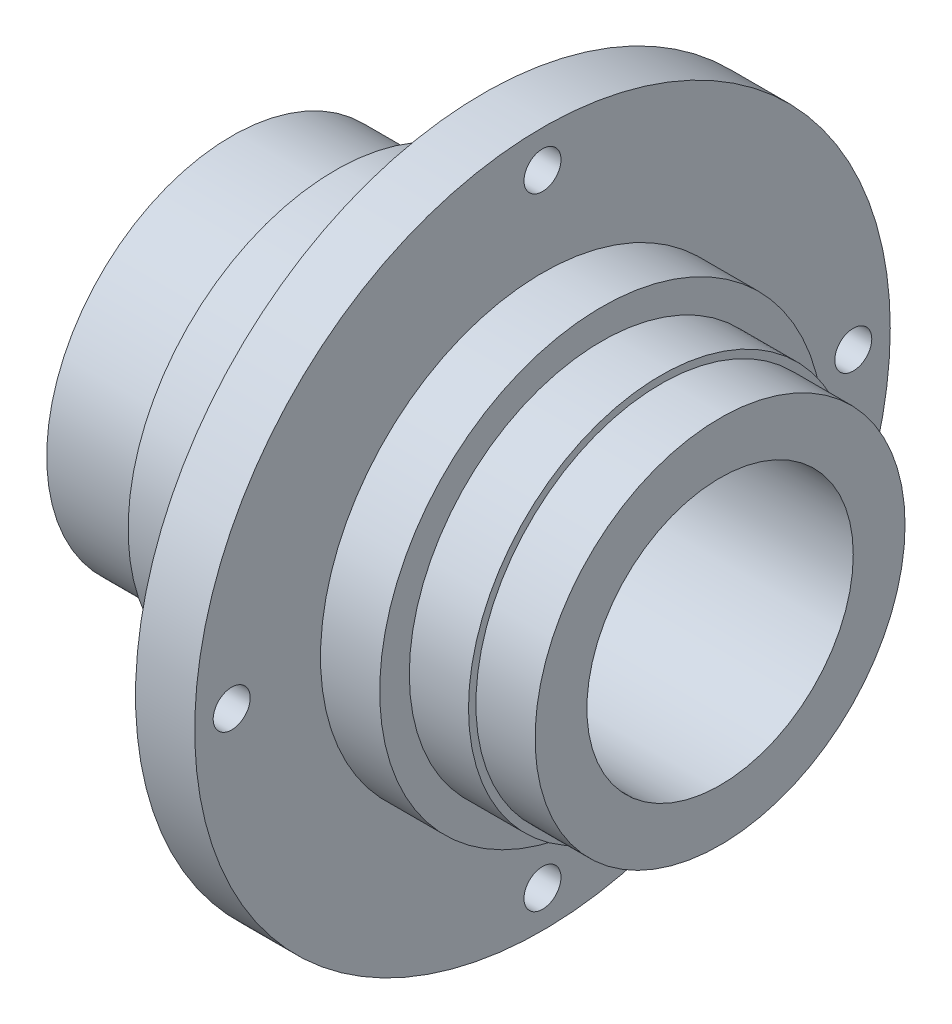
from build123d import *

# Parameters (mm, degrees)
SKETCH_1_R             = 12.5
EXTRUDE_1_DEPTH        = 7
SKETCH_2_R             = 14
EXTRUDE_2_DEPTH        = 10
SKETCH_3_R             = 23.5
EXTRUDE_3_DEPTH        = 4
HOLE_WIZARD_M3_1_D     = 2.5
HOLE_WIZARD_M3_1_DEPTH = 8.5
HOLE_WIZARD_M3_1_TIP   = 0.751075774
HOLE_WIZARD_M2_1_D     = 1.6
HOLE_WIZARD_M2_1_DEPTH = 6
HOLE_WIZARD_M2_1_TIP   = 0.480688495
SKETCH_14_R            = 15
EXTRUDE_4_DEPTH        = 4
SKETCH_15_R            = 13
EXTRUDE_5_DEPTH        = 4
SKETCH_16_R            = 12.5
EXTRUDE_6_DEPTH        = 4
SKETCH_4_R             = 9
CUT_EXTRUDE_2_DEPTH    = 47.834816109


with BuildPart() as part:
    # 草图1 → 凸台-拉伸1 (new body)
    with BuildSketch(Plane(origin=(0, 0, 0), x_dir=(0, 0, -1), z_dir=(1, 0, 0))):
        Circle(SKETCH_1_R)
    extrude(amount=EXTRUDE_1_DEPTH)

    # 草图2 → 凸台-拉伸2 (add)
    with BuildSketch(Plane(origin=(7, 0, 0), x_dir=(0, 0, -1), z_dir=(1, 0, 0))):
        Circle(SKETCH_2_R)
    extrude(amount=EXTRUDE_2_DEPTH)

    # 草图3 → 凸台-拉伸3 (add)
    with BuildSketch(Plane(origin=(17, 0, 0), x_dir=(0, 0, -1), z_dir=(1, 0, 0))):
        Circle(SKETCH_3_R)
    extrude(amount=EXTRUDE_3_DEPTH)

    # M3 螺纹孔1
    with Locations(Plane(origin=(21, 0, 0), x_dir=(0, 0, -1), z_dir=(1, 0, 0))):
        with Locations((0, 21), (21, 0), (0, -21), (-21, 0)):
            Hole(HOLE_WIZARD_M3_1_D / 2, depth=HOLE_WIZARD_M3_1_DEPTH)
            with Locations((0, 0, -(HOLE_WIZARD_M3_1_DEPTH + HOLE_WIZARD_M3_1_TIP / 2))):  # 118° drill point
                Cone(0, HOLE_WIZARD_M3_1_D / 2, HOLE_WIZARD_M3_1_TIP, mode=Mode.SUBTRACT)

    # M2 螺纹孔1
    with Locations(Plane.ZY):
        with Locations((-11, 0), (0, -11), (11, 0), (0, 11)):
            Hole(HOLE_WIZARD_M2_1_D / 2, depth=HOLE_WIZARD_M2_1_DEPTH)
            with Locations((0, 0, -(HOLE_WIZARD_M2_1_DEPTH + HOLE_WIZARD_M2_1_TIP / 2))):  # 118° drill point
                Cone(0, HOLE_WIZARD_M2_1_D / 2, HOLE_WIZARD_M2_1_TIP, mode=Mode.SUBTRACT)

    # 草图14 → 凸台-拉伸4 (add)
    with BuildSketch(Plane(origin=(21, 0, 0), x_dir=(0, 0, -1), z_dir=(1, 0, 0))):
        Circle(SKETCH_14_R)
    extrude(amount=EXTRUDE_4_DEPTH)

    # 草图15 → 凸台-拉伸5 (add)
    with BuildSketch(Plane(origin=(25, 0, 0), x_dir=(0, 0, -1), z_dir=(1, 0, 0))):
        Circle(SKETCH_15_R)
    extrude(amount=EXTRUDE_5_DEPTH)

    # 草图16 → 凸台-拉伸6 (add)
    with BuildSketch(Plane(origin=(29, 0, 0), x_dir=(0, 0, -1), z_dir=(1, 0, 0))):
        Circle(SKETCH_16_R)
    extrude(amount=EXTRUDE_6_DEPTH)

    # 草图4 → 切除-拉伸2 (cut, through all)
    with BuildSketch(Plane(origin=(0, 0, 0), x_dir=(0, 0, -1), z_dir=(1, 0, 0))):
        Circle(SKETCH_4_R)
    extrude(amount=CUT_EXTRUDE_2_DEPTH, mode=Mode.SUBTRACT)


solid = part.part
